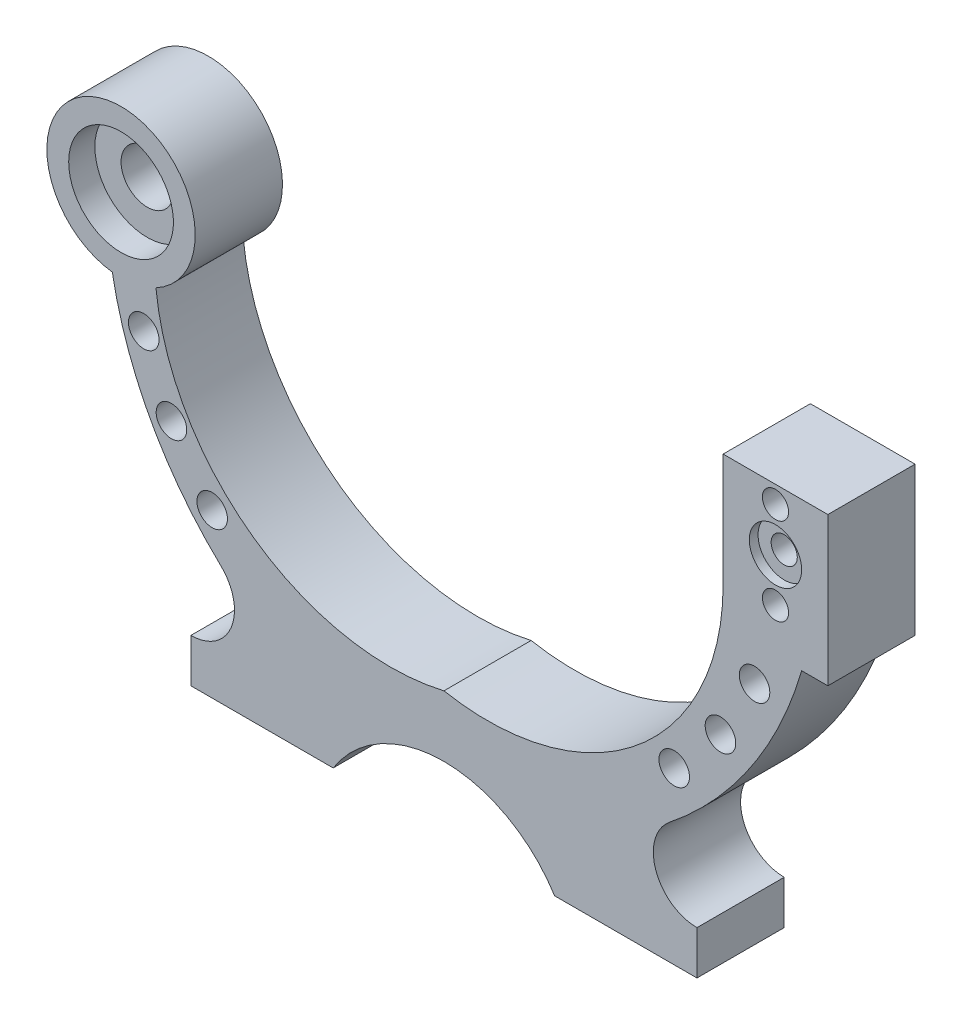
from build123d import *

# Parameters (mm, degrees)
EXTRUDE_1_DEPTH          = 5
SKETCH_2_R               = 3
CUT_EXTRUDE_1_DEPTH      = 1
CUT_EXTRUDE_2_DEPTH      = 91.056926441
CUT_EXTRUDE_2_DEPTH_BACK = 91.056926441
SKETCH_3_R               = 1.5
SKETCH_4_R               = 1.5
CUT_EXTRUDE_3_DEPTH      = 91.162353563
SKETCH_5_R               = 1.75
CUT_EXTRUDE_4_DEPTH      = 91.162353563
CUT_EXTRUDE_START        = -3
SKETCH_6_R               = 6
CUT_EXTRUDE_5_DEPTH      = 94.162353563
SKETCH_7_R               = 3
CUT_EXTRUDE_6_DEPTH      = 90.879085443


with BuildPart() as part:
    # 草图1 → 凸台-拉伸1 (new, symmetric)
    with BuildSketch(Plane(origin=(0, 0, 0), x_dir=(-1, 0, 0), z_dir=(0, 0, -1))):
        with BuildLine():
            Line((-7.5, 6), (8.81142246, 6))
            ThreePointArc((8.81142246, 6), (21.5, 13), (34.18857754, 6))
            Line((34.18857754, 6), (50.5, 6))
            Line((50.5, 6), (50.5, 11))
            ThreePointArc((50.5, 11), (45.852558058, 14.155743132), (47.071569313, 19.639486643))
            ThreePointArc((47.071569313, 19.639486643), (55.125553128, 30.1016183), (59.5, 42.559028492))
            ThreePointArc((59.5, 42.559028492), (60.072054975, 59.353361189), (54.5, 43.5))
            ThreePointArc((54.5, 43.5), (43.306585473, 24.298199123), (21.5, 20))
            ThreePointArc((21.5, 20), (-0.73368794, 25.748388632), (-10.5, 46.532998323))
            Line((-10.5, 46.532998323), (-10.5, 59.5))
            Line((-10.5, 59.5), (-22.5, 59.5))
            Line((-22.5, 59.5), (-22.5, 42.5))
            Line((-22.5, 42.5), (-19.5, 42.5))
            ThreePointArc((-19.5, 42.5), (-13.686520363, 30.033883058), (-4.37890781, 19.906249293))
            ThreePointArc((-4.37890781, 19.906249293), (-2.781353665, 14.346404897), (-7.5, 11))
            Line((-7.5, 11), (-7.5, 6))
        make_face()
    extrude(amount=EXTRUDE_1_DEPTH, both=True)

    # 草图2 → 切除-拉伸1 (cut)
    with BuildSketch(Plane.XY.offset(5)):
        with Locations((16.5, 52.5)):
            Circle(SKETCH_2_R)
    cut_extrude_1 = extrude(amount=-CUT_EXTRUDE_1_DEPTH, mode=Mode.SUBTRACT)

    # 草图3 → 切除-拉伸2 (cut, two sides: drawn at the far end of the back side and taken through both)
    with BuildSketch(Plane.XY.offset(4).offset(-CUT_EXTRUDE_2_DEPTH_BACK)):
        with Locations((16.5, 52.5)):
            Circle(SKETCH_3_R)
    extrude(amount=CUT_EXTRUDE_2_DEPTH + CUT_EXTRUDE_2_DEPTH_BACK, mode=Mode.SUBTRACT)

    # 草图4 → 切除-拉伸3 (cut, through all)
    with BuildSketch(Plane.XY.offset(5)):
        with Locations((16.5, 57.5)):
            Circle(SKETCH_4_R)
        with Locations((16.5, 47.5)):
            Circle(SKETCH_4_R)
    extrude(amount=-CUT_EXTRUDE_3_DEPTH, mode=Mode.SUBTRACT)

    # 草图5 → 切除-拉伸4 (cut, through all)
    with BuildSketch(Plane.XY.offset(5)):
        with Locations((14.099159256, 38.5)):
            Circle(SKETCH_5_R)
        with Locations((10.191784732, 31.519138712)):
            Circle(SKETCH_5_R)
        with Locations((4.897441914, 25.521644724)):
            Circle(SKETCH_5_R)
        with Locations((-55.897925178, 38.5)):
            Circle(SKETCH_5_R)
        with Locations((-52.723592313, 31.156730234)):
            Circle(SKETCH_5_R)
        with Locations((-48.053046301, 24.661655181)):
            Circle(SKETCH_5_R)
    extrude(amount=-CUT_EXTRUDE_4_DEPTH, mode=Mode.SUBTRACT)

    # 镜向1: 切除-拉伸1 across plane
    add(cut_extrude_1.mirror(Plane(origin=(0, 0, 0), x_dir=(1, 0, 0), z_dir=(0, 0, -1))), mode=Mode.SUBTRACT)

    # 草图6 → 切除-拉伸5 (cut)
    with BuildSketch(Plane.XY.offset(5).offset(CUT_EXTRUDE_START)):
        with Locations((-58.5, 51)):
            Circle(SKETCH_6_R)
    cut_extrude_5 = extrude(amount=CUT_EXTRUDE_5_DEPTH, mode=Mode.SUBTRACT)

    # 镜向2: 切除-拉伸5 across plane
    add(cut_extrude_5.mirror(Plane.XY), mode=Mode.SUBTRACT)

    # 草图7 → 切除-拉伸6 (cut, through all)
    with BuildSketch(Plane.XY.offset(2)):
        with Locations((-58.5, 51)):
            Circle(SKETCH_7_R)
    extrude(amount=-CUT_EXTRUDE_6_DEPTH, mode=Mode.SUBTRACT)


solid = part.part
